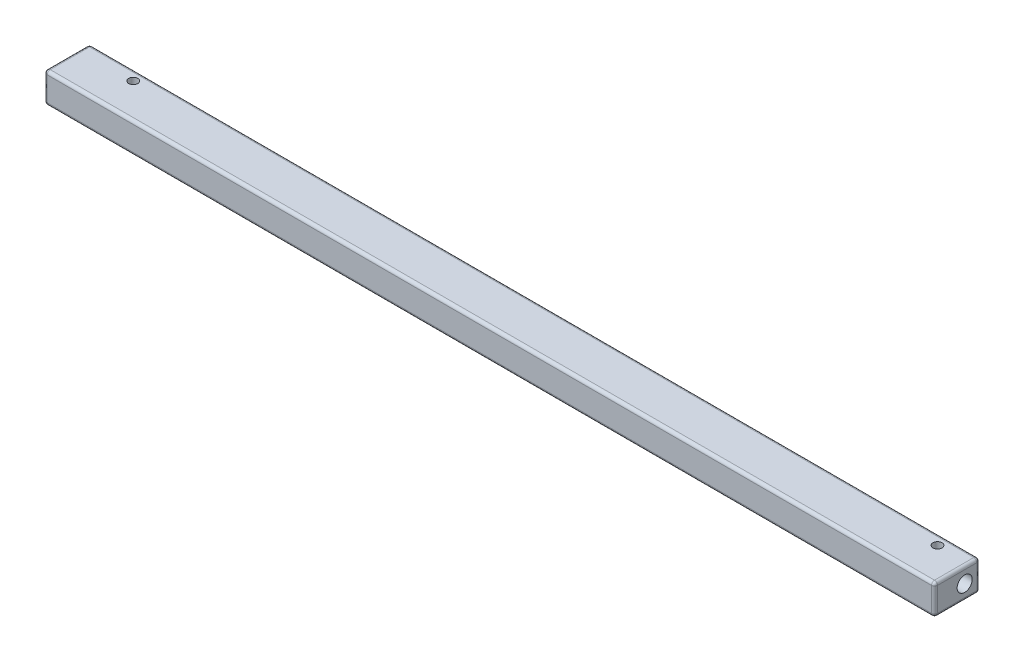
from build123d import *

# Parameters (mm, degrees)
SKETCH1_W           = 590
SKETCH1_H           = 20
BOSS_EXTRUDE1_DEPTH = 30
FILLET1_R           = 2
SKETCH6_R           = 5
CUT_EXTRUDE5_DEPTH  = 8
SKETCH7_R           = 5
CUT_EXTRUDE6_DEPTH  = 8
SKETCH8_R           = 3
CUT_EXTRUDE7_DEPTH  = 298.195222034


with BuildPart() as part:
    # Sketch1 → Boss-Extrude1 (new body)
    with BuildSketch(Plane.XY):
        with Locations((0, 10)):
            Rectangle(SKETCH1_W, SKETCH1_H)
    extrude(amount=BOSS_EXTRUDE1_DEPTH)

    # Fillet1
    fillet1_edges = [part.edges().sort_by_distance(p)[0] for p in [
        (295, 10, 30),
        (0, 20, 30),
        (-295, 10, 30),
        (0, 20, 0),
        (295, 10, 0),
        (0, 0, 0),
        (-295, 10, 0),
        (-295, 20, 15),
        (295, 20, 15),
        (295, 0, 15),
        (-295, 0, 15),
        (0, 0, 30),
    ]]
    fillet(fillet1_edges, radius=FILLET1_R)

    # Sketch6 → Cut-Extrude5 (cut)
    with BuildSketch(Plane(origin=(295, 0, 0), x_dir=(0, 0, -1), z_dir=(1, 0, 0))):
        with Locations((-10, 10)):
            Circle(SKETCH6_R)
    extrude(amount=-CUT_EXTRUDE5_DEPTH, mode=Mode.SUBTRACT)

    # Sketch7 → Cut-Extrude6 (cut)
    with BuildSketch(Plane.ZY.offset(295)):
        with Locations((15, 10)):
            Circle(SKETCH7_R)
    extrude(amount=-CUT_EXTRUDE6_DEPTH, mode=Mode.SUBTRACT)

    # Sketch8 → Cut-Extrude7 (cut, through all)
    with BuildSketch(Plane.XZ):
        with Locations(Location((-259, 7, 0), (0, 0, 90))):
            Circle(SKETCH8_R)
        with Locations(Location((274, 7, 0), (0, 0, 270))):
            Circle(SKETCH8_R)
    extrude(amount=-CUT_EXTRUDE7_DEPTH, mode=Mode.SUBTRACT)


solid = part.part
